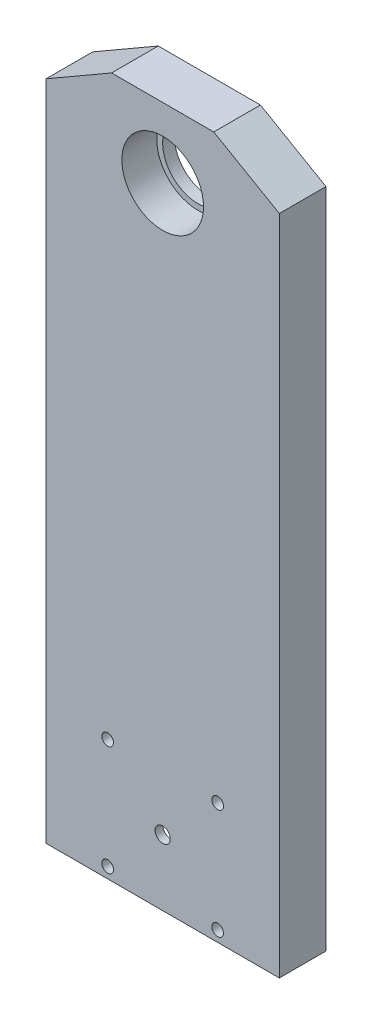
from build123d import *

# Parameters (mm, degrees)
SZKIC1_R                    = 17.5
DODANIE_WYCI_GNI_CIE1_DEPTH = 20
SZKIC1_3_R                  = 17.5
SZKIC1_3_R_2                = 15
DODANIE_WYCI_GNI_CIE2_DEPTH = 5
OTW_R_GWINTOWANY_M81_D      = 6.8
OTW_R_GWINTOWANY_M81_DEPTH  = 40
OTW_R_GWINTOWANY_M81_TIP    = 2.042926105
SZKIC4_R                    = 3.25
WYTNIJ_WYCI_GNI_CIE2_DEPTH  = 15
SZKIC4_4_R                  = 19.05
SZKIC4_4_R_2                = 3.25
WYTNIJ_WYCI_GNI_CIE3_DEPTH  = 16.6
SZKIC4_5_R                  = 3.25
WYTNIJ_WYCI_GNI_CIE4_DEPTH  = 49.6
WYTNIJ_WYCI_GNI_CIE6_DEPTH  = 10
OTW_R_GWINTOWANY_M61_D      = 5


with BuildPart() as part:
    # Szkic1 → Dodanie-wyciągnięcie1 (new body)
    with BuildSketch(Plane.XY):
        Polygon((-50, 0), (50, 0), (50, 283.776622614), (21.900286098, 300), (-21.900286098, 300), (-50, 283.776622614), align=None)
        with Locations((0, 270)):
            Circle(SZKIC1_R, mode=Mode.SUBTRACT)
    extrude(amount=DODANIE_WYCI_GNI_CIE1_DEPTH)

    # Szkic1<3> → Dodanie-wyciągnięcie2 (add)
    with BuildSketch(Plane.XY):
        with Locations((0, 270)):
            Circle(SZKIC1_3_R)
        with Locations((0, 270)):
            Circle(SZKIC1_3_R_2, mode=Mode.SUBTRACT)
    extrude(amount=DODANIE_WYCI_GNI_CIE2_DEPTH)

    # Otwór gwintowany M81
    with Locations(Plane(origin=(-35, 0, 10), x_dir=(0, 0, -1), z_dir=(0, -1, 0))):
        with Locations((0, 0), (0, 70)):
            Hole(OTW_R_GWINTOWANY_M81_D / 2, depth=OTW_R_GWINTOWANY_M81_DEPTH)
            with Locations((0, 0, -(OTW_R_GWINTOWANY_M81_DEPTH + OTW_R_GWINTOWANY_M81_TIP / 2))):  # 118° drill point
                Cone(0, OTW_R_GWINTOWANY_M81_D / 2, OTW_R_GWINTOWANY_M81_TIP, mode=Mode.SUBTRACT)

    # Szkic4 → Wytnij-wyciągnięcie2 (cut)
    with BuildSketch(Plane(origin=(0, 0, 0), x_dir=(-1, 0, 0), z_dir=(0, 0, -1))):
        with BuildLine():
            Line((-28.2, 53.4), (-28.2, 0))
            Line((-28.2, 0), (28.2, 0))
            Line((28.2, 0), (28.2, 53.4))
            ThreePointArc((28.2, 53.4), (27.321320344, 55.521320344), (25.2, 56.4))
            Line((25.2, 56.4), (-25.2, 56.4))
            ThreePointArc((-25.2, 56.4), (-27.321320344, 55.521320344), (-28.2, 53.4))
        make_face()
        with Locations((0, 28.2)):
            Circle(SZKIC4_R, mode=Mode.SUBTRACT)
    extrude(amount=-WYTNIJ_WYCI_GNI_CIE2_DEPTH, mode=Mode.SUBTRACT)

    # Szkic4<4> → Wytnij-wyciągnięcie3 (cut)
    with BuildSketch(Plane(origin=(0, 0, 0), x_dir=(-1, 0, 0), z_dir=(0, 0, -1))):
        with Locations((0, 28.2)):
            Circle(SZKIC4_4_R)
        with Locations((0, 28.2)):
            Circle(SZKIC4_4_R_2, mode=Mode.SUBTRACT)
    extrude(amount=-WYTNIJ_WYCI_GNI_CIE3_DEPTH, mode=Mode.SUBTRACT)

    # Szkic4<5> → Wytnij-wyciągnięcie4 (cut)
    with BuildSketch(Plane(origin=(0, 0, 0), x_dir=(-1, 0, 0), z_dir=(0, 0, -1))):
        with Locations((0, 28.2)):
            Circle(SZKIC4_5_R)
    extrude(amount=-WYTNIJ_WYCI_GNI_CIE4_DEPTH, mode=Mode.SUBTRACT)

    # Szkic6 → Wytnij-wyciągnięcie6 (cut)
    with BuildSketch(Plane(origin=(0, 0, 0), x_dir=(-1, 0, 0), z_dir=(0, 0, -1))):
        with BuildLine():
            Line((-45, 228.928061115), (-45, 82.471938885))
            ThreePointArc((-45, 82.471938885), (-43.078190139, 80.039718467), (-40.267443069, 81.346910197))
            Line((-40.267443069, 81.346910197), (-5.067175687, 151.199885246))
            ThreePointArc((-5.067175687, 151.199885246), (-3.997403411, 155.7), (-5.067175687, 160.200114754))
            Line((-5.067175687, 160.200114754), (-40.267443069, 230.053089803))
            ThreePointArc((-40.267443069, 230.053089803), (-43.078190139, 231.360281533), (-45, 228.928061115))
        make_face()
        with BuildLine():
            Line((2.232556931, 145.714200914), (38.342819518, 74.055390936))
            ThreePointArc((38.342819518, 74.055390936), (38.218169264, 71.13215965), (35.663751201, 69.70535651))
            Line((35.663751201, 69.70535651), (-35.663751201, 69.70535651))
            ThreePointArc((-35.663751201, 69.70535651), (-38.218169264, 71.13215965), (-38.342819518, 74.055390936))
            Line((-38.342819518, 74.055390936), (-2.232556931, 145.714200914))
            ThreePointArc((-2.232556931, 145.714200914), (0, 147.089172226), (2.232556931, 145.714200914))
        make_face()
        with BuildLine():
            Line((45, 228.928061115), (45, 82.471938885))
            ThreePointArc((45, 82.471938885), (43.078190139, 80.039718467), (40.267443069, 81.346910197))
            Line((40.267443069, 81.346910197), (5.067175687, 151.199885246))
            ThreePointArc((5.067175687, 151.199885246), (3.997403411, 155.7), (5.067175687, 160.200114754))
            Line((5.067175687, 160.200114754), (40.267443069, 230.053089803))
            ThreePointArc((40.267443069, 230.053089803), (43.078190139, 231.360281533), (45, 228.928061115))
        make_face()
        with BuildLine():
            Line((-40.008452698, 240.649965574), (-2.232556931, 165.685799086))
            ThreePointArc((-2.232556931, 165.685799086), (0, 164.310827774), (2.232556931, 165.685799086))
            Line((2.232556931, 165.685799086), (40.008452698, 240.649965574))
            ThreePointArc((40.008452698, 240.649965574), (39.883802443, 243.57319686), (37.329384381, 245))
            Line((37.329384381, 245), (-37.32938438, 245))
            ThreePointArc((-37.32938438, 245), (-39.883802443, 243.57319686), (-40.008452698, 240.649965574))
        make_face()
    extrude(amount=-WYTNIJ_WYCI_GNI_CIE6_DEPTH, mode=Mode.SUBTRACT)

    # Otwór gwintowany M61 (through all)
    with Locations(Plane(origin=(23.57, 51.77, 15), x_dir=(-1, 0, 0), z_dir=(0, 0, -1))):
        with Locations((0, 0), (47.14, 0), (47.14, -47.14), (0, -47.14)):
            Hole(OTW_R_GWINTOWANY_M61_D / 2)


solid = part.part
